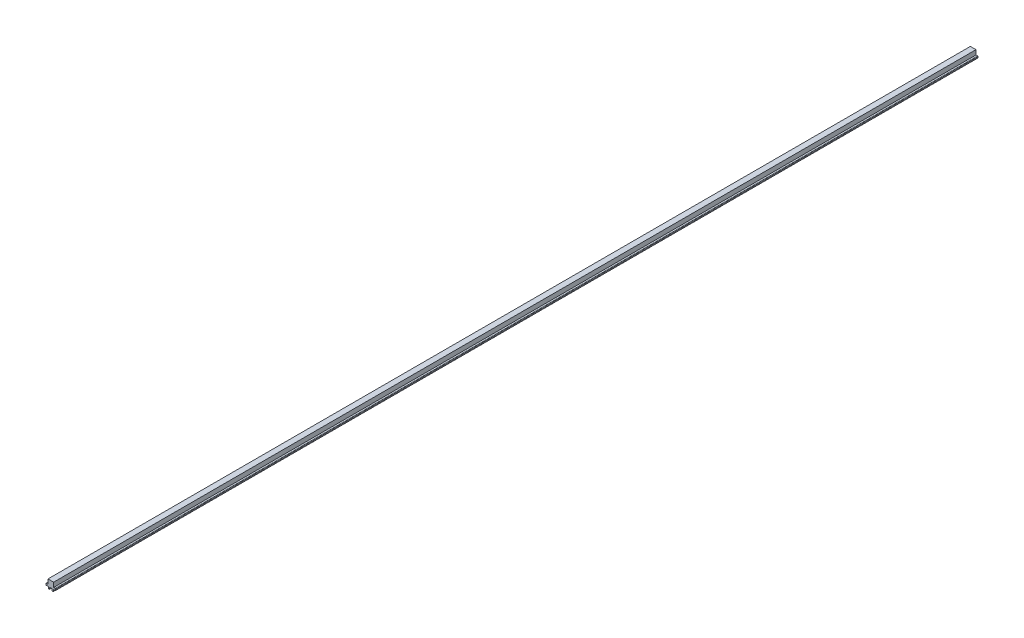
from build123d import *

# Parameters (mm, degrees)
SKETCH2_W           = 3.05
SKETCH2_H           = 2.25
SKETCH2_W_2         = 2.2
SKETCH2_H_2         = 2
SKETCH2_W_3         = 1.5
SKETCH2_H_3         = 2.2
BOSS_EXTRUDE1_DEPTH = 1000
FILLET1_R           = 0.5
FILLET2_R           = 0.5


with BuildPart() as part:
    # Sketch2 → Boss-Extrude1 (new body)
    with BuildSketch(Plane.XY):
        with Locations((0.108353761, 4.001842427)):
            Rectangle(SKETCH2_W, SKETCH2_H)
        Polygon((-1.416646239, -1.873157573), (-1.416646239, 2.876842427), (-4.466646239, 2.876842427), (-4.466646239, 0.126842427), (-4.466646239, -1.873157573), (-4.216646239, -1.873157573), (-2.716646239, -1.873157573), align=None)
        Polygon((1.633353761, 2.876842427), (-1.416646239, 2.876842427), (-1.416646239, -1.873157573), (-0.116646239, -1.873157573), (1.383353761, -1.873157573), (1.633353761, -1.873157573), (1.633353761, 0.126842427), align=None)
        with Locations((-2.941646239, 4.001842427)):
            Rectangle(SKETCH2_W, SKETCH2_H)
        with Locations((2.733353761, -0.873157573)):
            Rectangle(SKETCH2_W_2, SKETCH2_H_2)
        with Locations((0.633353761, -2.973157573)):
            Rectangle(SKETCH2_W_3, SKETCH2_H_3)
        with Locations((-3.466646239, -2.973157573)):
            Rectangle(SKETCH2_W_3, SKETCH2_H_3)
        with Locations((-5.566646239, -0.873157573)):
            Rectangle(SKETCH2_W_2, SKETCH2_H_2)
    extrude(amount=BOSS_EXTRUDE1_DEPTH)

    # Fillet1
    fillet1_edges = [part.edges().sort_by_distance(p)[0] for p in [
        (3.833353761, 0.126842427, 500),
        (3.833353761, -1.873157573, 500),
        (-6.666646239, -1.873157573, 500),
        (-6.666646239, 0.126842427, 500),
    ]]
    fillet(fillet1_edges, radius=FILLET1_R)

    # Fillet2
    fillet2_edges = [part.edges().sort_by_distance(p)[0] for p in [
        (1.383353761, -4.073157573, 500),
        (-0.116646239, -4.073157573, 500),
        (-2.716646239, -4.073157573, 500),
        (-4.216646239, -4.073157573, 500),
    ]]
    fillet(fillet2_edges, radius=FILLET2_R)


solid = part.part
